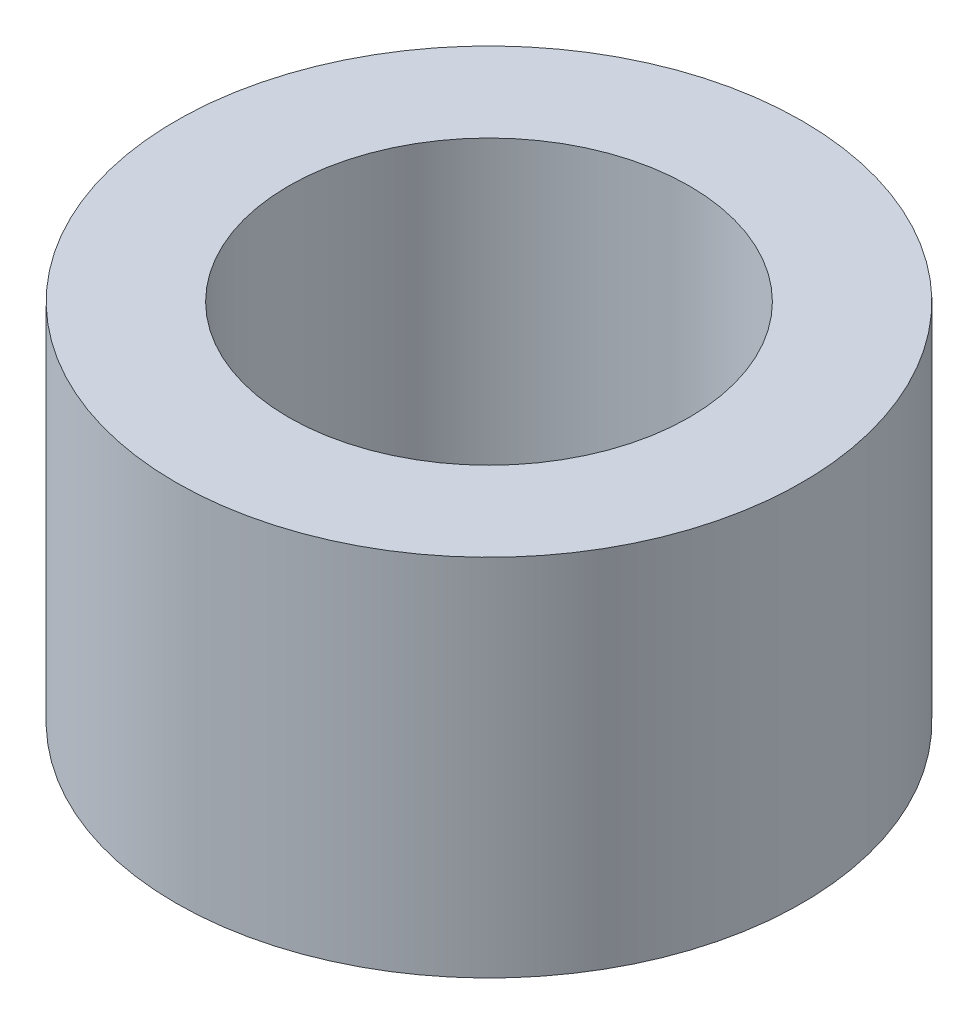
from build123d import *

# Parameters (mm, degrees)
SKETCH_1_R      = 2.578125
SKETCH_1_R_2    = 1.65
EXTRUDE_1_DEPTH = 3


with BuildPart() as part:
    # 草图1 → 凸台-拉伸1 (new body)
    with BuildSketch(Plane(origin=(0, 0, 0), x_dir=(1, 0, 0), z_dir=(0, 1, 0))):
        with Locations(Location((0, 0, 0), (0, 0, 270))):
            Circle(SKETCH_1_R)
        with Locations(Location((0, 0, 0), (0, 0, 270))):
            Circle(SKETCH_1_R_2, mode=Mode.SUBTRACT)
    extrude(amount=EXTRUDE_1_DEPTH)


solid = part.part
